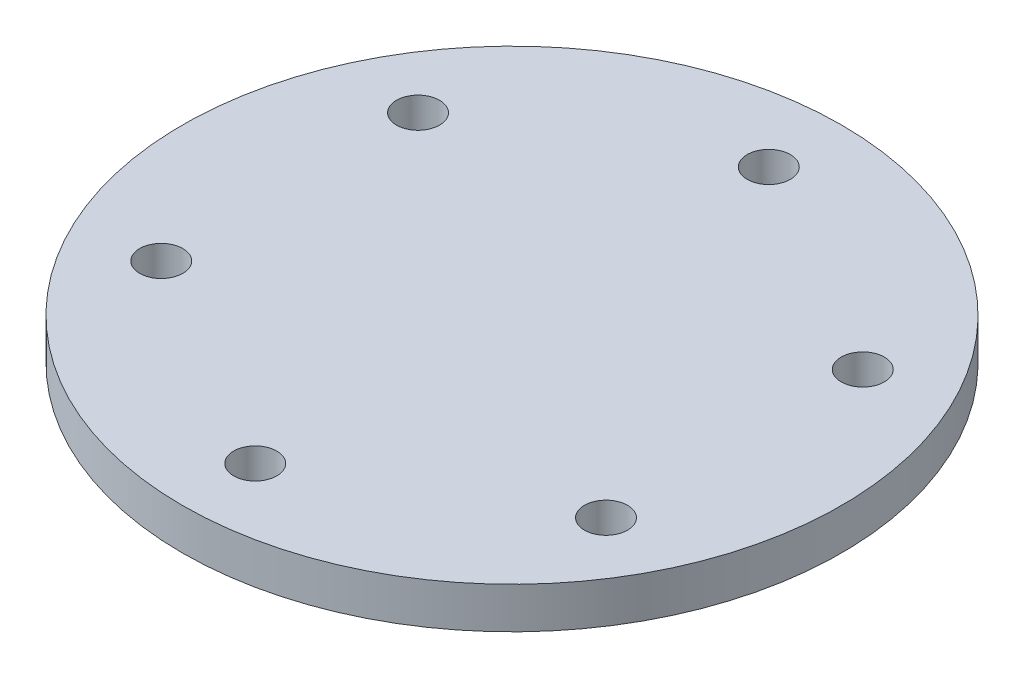
from build123d import *

# Parameters (mm, degrees)
SKETCH1_R           = 30.48
BOSS_EXTRUDE1_DEPTH = 3.81
SKETCH2_R           = 1.9939
CUT_EXTRUDE1_DEPTH  = 44.273281595
CIRPATTERN1_COUNT   = 6


with BuildPart() as part:
    # Sketch1 → Boss-Extrude1 (new body)
    with BuildSketch(Plane(origin=(0, 0, 0), x_dir=(1, 0, 0), z_dir=(0, 1, 0))):
        with Locations(Location((0, 0, 0), (0, 0, 90))):
            Circle(SKETCH1_R)
    extrude(amount=BOSS_EXTRUDE1_DEPTH)

    # Sketch2 → Cut-Extrude1 (cut, through all)
    with BuildSketch(Plane(origin=(0, 3.81, 0), x_dir=(1, 0, 0), z_dir=(0, 1, 0))):
        with Locations(Location((0, -23.749, 0), (0, 0, 270))):
            Circle(SKETCH2_R)
    cut_extrude1 = extrude(amount=-CUT_EXTRUDE1_DEPTH, mode=Mode.SUBTRACT)

    # CirPattern1: Cut-Extrude1 ×6 about axis
    cirpattern1_axis = Axis((0, 0, 0), (0, 1, 0))
    for i in range(1, CIRPATTERN1_COUNT):
        add(cut_extrude1.rotate(cirpattern1_axis, i * 360 / CIRPATTERN1_COUNT), mode=Mode.SUBTRACT)


solid = part.part
